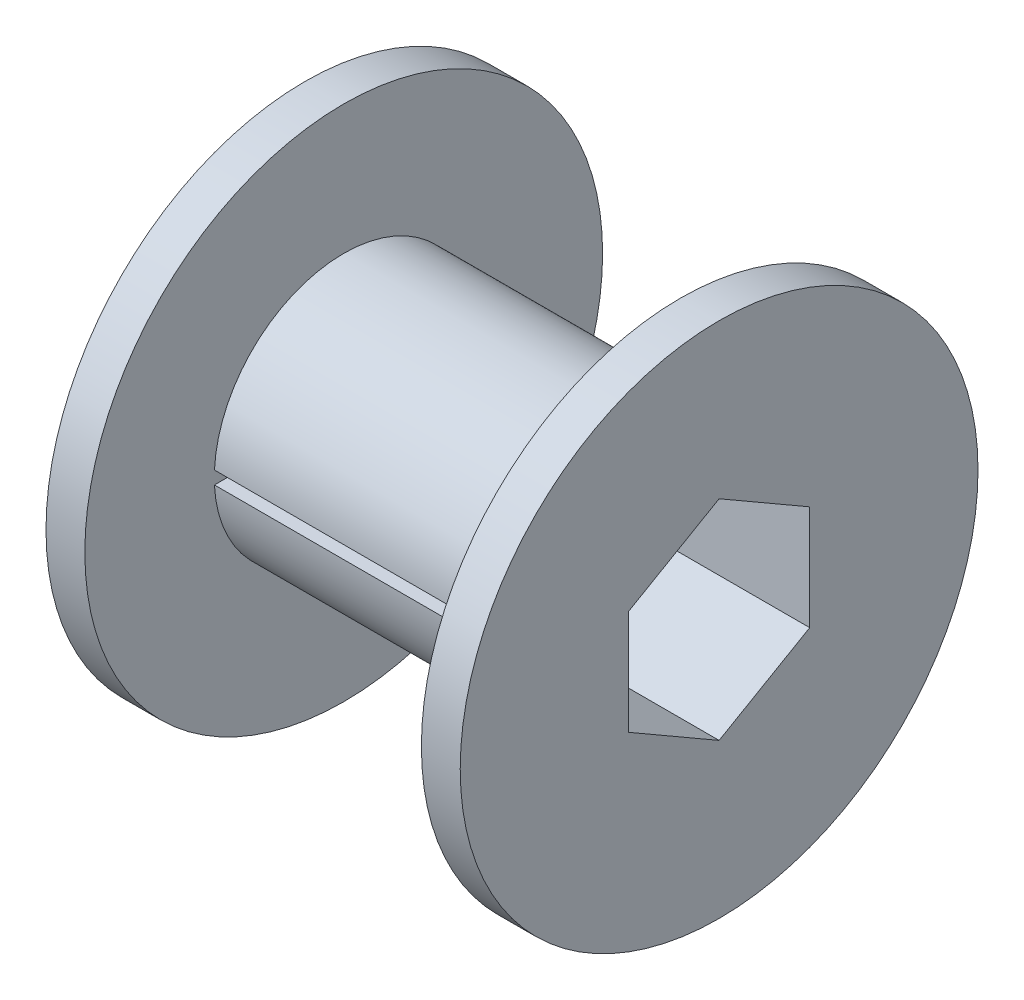
from build123d import *

# Parameters (mm, degrees)
SKETCH1_R           = 2.5
BOSS_EXTRUDE1_DEPTH = 4
SKETCH2_R           = 5
BOSS_EXTRUDE2_DEPTH = 0.75
M1_6_NUT_DEPTH      = 9.124038405
M1_6_NUT_DEPTH_BACK = 9.124038405
SKETCH5_W           = 6.5
SKETCH5_H           = 0.25
CUT_EXTRUDE1_DEPTH  = 9.124038405


with BuildPart() as part:
    # Sketch1 → Boss-Extrude1 (new, symmetric)
    with BuildSketch(Plane(origin=(0, 0, 0), x_dir=(0, 0, -1), z_dir=(1, 0, 0))):
        Circle(SKETCH1_R)
    extrude(amount=BOSS_EXTRUDE1_DEPTH, both=True)

    # Sketch2 → Boss-Extrude2 (add)
    with BuildSketch(Plane(origin=(4, 0, 0), x_dir=(0, 0, -1), z_dir=(1, 0, 0))):
        Circle(SKETCH2_R)
    boss_extrude2 = extrude(amount=-BOSS_EXTRUDE2_DEPTH)

    # Mirror1: Boss-Extrude2 across plane
    add(boss_extrude2.mirror(Plane(origin=(0, 0, 0), x_dir=(0, 0, 1), z_dir=(1, 0, 0))))

    # Sketch3 → M1.6 Nut (cut, two sides: drawn at the far end of the back side and taken through both)
    with BuildSketch(Plane(origin=(0, 0, 0), x_dir=(0, 0, -1), z_dir=(1, 0, 0)).offset(-M1_6_NUT_DEPTH_BACK)):
        Polygon((1.75, 0), (1.75, 1.010362971), (0.875, 1.515544457), (0, 2.020725942), (-0.875, 1.515544457), (-1.75, 1.010362971), (-1.75, 0), (-1.75, -1.010362971), (-0.875, -1.515544457), (0, -2.020725942), (0.875, -1.515544457), (1.75, -1.010362971), align=None)
    extrude(amount=M1_6_NUT_DEPTH + M1_6_NUT_DEPTH_BACK, mode=Mode.SUBTRACT)

    # Sketch5 → Cut-Extrude1 (cut, through all)
    with BuildSketch(Plane.XY):
        Rectangle(SKETCH5_W, SKETCH5_H)
    extrude(amount=CUT_EXTRUDE1_DEPTH, mode=Mode.SUBTRACT)


solid = part.part
